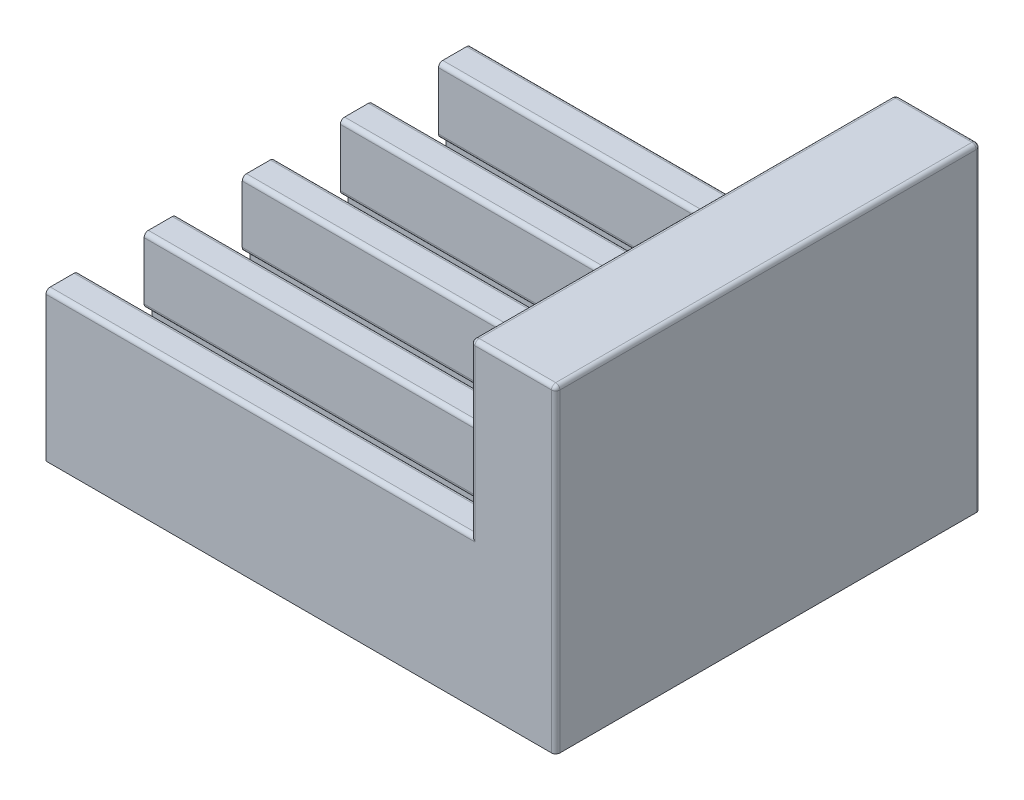
from build123d import *

# Parameters (mm, degrees)
SKETCH1_W           = 120
SKETCH1_H           = 100
BOSS_EXTRUDE1_DEPTH = 75
SKETCH2_W           = 100
SKETCH2_H           = 100
CUT_EXTRUDE1_DEPTH  = 40
SKETCH6_W           = 15.5
SKETCH6_H           = 15.5
CUT_EXTRUDE4_DEPTH  = 100
SKETCH8_W           = 19.1
SKETCH8_H           = 10
CUT_EXTRUDE5_DEPTH  = 100
SKETCH6_3_R         = 5.95
CUT_EXTRUDE6_DEPTH  = 111
FILLET1_R           = 1
CHAMFER1_SIZE       = 1
FILLET2_R           = 0.5
FILLET3_R           = 1


with BuildPart() as part:
    # Sketch1 → Boss-Extrude1 (new body)
    with BuildSketch(Plane(origin=(0, 0, 0), x_dir=(1, 0, 0), z_dir=(0, 1, 0))):
        with Locations((-3.53539823, -7.581858407)):
            Rectangle(SKETCH1_W, SKETCH1_H)
    extrude(amount=BOSS_EXTRUDE1_DEPTH)

    # Sketch2 → Cut-Extrude1 (cut)
    with BuildSketch(Plane(origin=(0, 75, 0), x_dir=(1, 0, 0), z_dir=(0, 1, 0))):
        with Locations((-13.53539823, -7.581858407)):
            Rectangle(SKETCH2_W, SKETCH2_H)
    extrude(amount=-CUT_EXTRUDE1_DEPTH, mode=Mode.SUBTRACT)

    # Sketch6 → Cut-Extrude4 (cut)
    with BuildSketch(Plane.ZY.offset(63.53539823)):
        with Locations((-27.068141593, 27.25)):
            Rectangle(SKETCH6_W, SKETCH6_H)
        with Locations((-3.968141593, 27.25)):
            Rectangle(SKETCH6_W, SKETCH6_H)
        with Locations((19.131858407, 27.25)):
            Rectangle(SKETCH6_W, SKETCH6_H)
        with Locations((42.231858407, 27.25)):
            Rectangle(SKETCH6_W, SKETCH6_H)
    extrude(amount=-CUT_EXTRUDE4_DEPTH, mode=Mode.SUBTRACT)

    # Sketch8 → Cut-Extrude5 (cut)
    with BuildSketch(Plane.ZY.offset(63.53539823)):
        with Locations((-27.068141593, 14.5)):
            Rectangle(SKETCH8_W, SKETCH8_H)
        with Locations((-3.968141593, 14.5)):
            Rectangle(SKETCH8_W, SKETCH8_H)
        with Locations((42.231858407, 14.5)):
            Rectangle(SKETCH8_W, SKETCH8_H)
        with Locations((19.131858407, 14.5)):
            Rectangle(SKETCH8_W, SKETCH8_H)
    extrude(amount=-CUT_EXTRUDE5_DEPTH, mode=Mode.SUBTRACT)

    # Sketch6<3> → Cut-Extrude6 (cut)
    with BuildSketch(Plane.ZY.offset(63.53539823)):
        with Locations((-27.068141593, 27.25)):
            Circle(SKETCH6_3_R)
        with Locations((-3.968141593, 27.25)):
            Circle(SKETCH6_3_R)
        with Locations((42.231858407, 27.25)):
            Circle(SKETCH6_3_R)
        with Locations((19.131858407, 27.25)):
            Circle(SKETCH6_3_R)
    extrude(amount=-CUT_EXTRUDE6_DEPTH, mode=Mode.SUBTRACT)

    # Fillet1
    fillet1_edges = [part.edges().sort_by_distance(p)[0] for p in [
        (-13.53539823, 35, -42.418141593),
        (-13.53539823, 35, 57.581858407),
        (36.46460177, 55, -42.418141593),
        (36.46460177, 55, 57.581858407),
        (46.46460177, 75, 57.581858407),
        (36.46460177, 75, 7.581858407),
        (46.46460177, 75, -42.418141593),
        (56.46460177, 75, 7.581858407),
        (56.46460177, 37.5, 57.581858407),
        (56.46460177, 37.5, -42.418141593),
    ]]
    fillet(fillet1_edges, radius=FILLET1_R)

    # Chamfer1
    chamfer1_edges = [part.edges().sort_by_distance(p)[0] for p in [
        (36.46460177, 27.25, 36.281858407),
        (36.46460177, 27.25, 13.181858407),
        (36.46460177, 27.25, -9.918141593),
        (36.46460177, 27.25, -33.018141593),
    ]]
    chamfer(chamfer1_edges, length=CHAMFER1_SIZE)

    # Fillet2
    fillet2_edges = [part.edges().sort_by_distance(p)[0] for p in [
        (47.46460177, 27.25, 36.281858407),
        (47.46460177, 27.25, 13.181858407),
        (47.46460177, 27.25, -9.918141593),
        (47.46460177, 27.25, -33.018141593),
    ]]
    fillet(fillet2_edges, radius=FILLET2_R)

    # Fillet3
    fillet3_edges = [part.edges().sort_by_distance(p)[0] for p in [
        (-13.53539823, 19.5, -19.318141593),
        (-13.53539823, 19.5, 3.781858407),
        (-13.53539823, 19.5, 26.881858407),
        (-13.53539823, 19.5, -34.818141593),
        (-13.53539823, 19.5, -11.718141593),
        (-13.53539823, 19.5, 11.381858407),
        (-13.53539823, 19.5, 34.481858407),
        (-13.53539823, 19.5, 49.981858407),
        (-13.53539823, 35, -34.818141593),
        (-13.53539823, 35, -19.318141593),
        (-13.53539823, 35, -11.718141593),
        (-13.53539823, 35, 3.781858407),
        (-13.53539823, 35, 26.881858407),
        (-13.53539823, 35, 11.381858407),
        (-13.53539823, 35, 34.481858407),
        (-13.53539823, 35, 49.981858407),
    ]]
    fillet(fillet3_edges, radius=FILLET3_R)


solid = part.part
